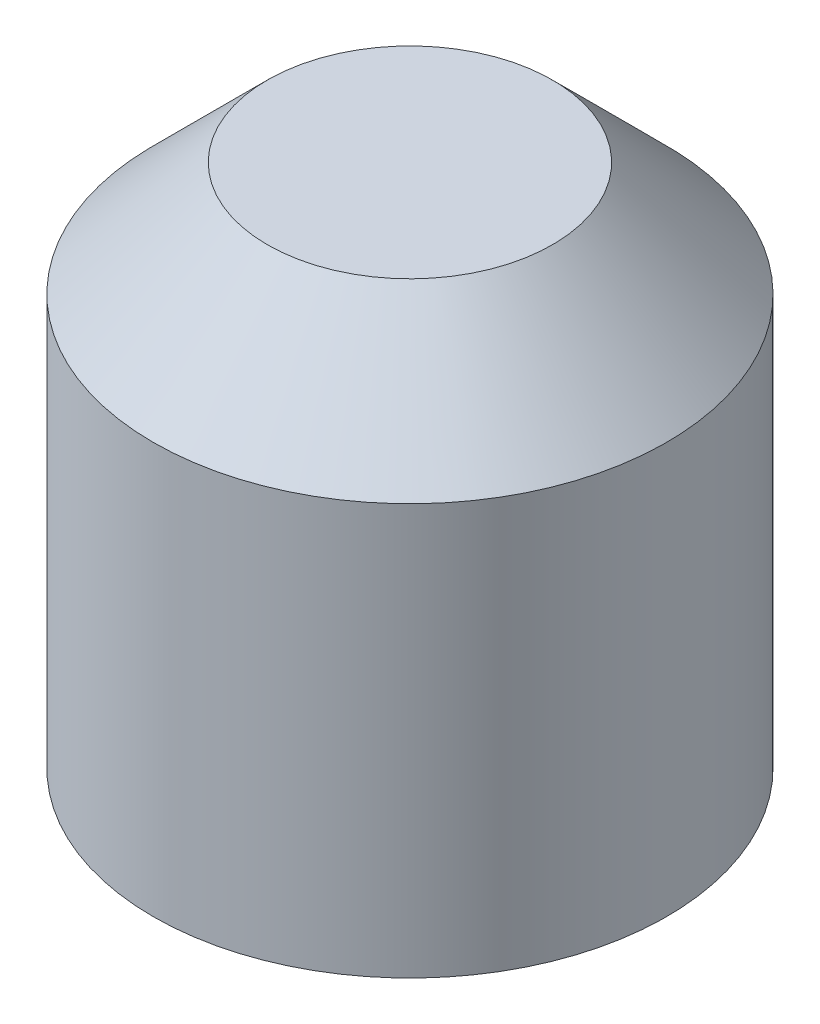
from build123d import *

# Parameters (mm, degrees)
SKETCH1_R           = 45
BOSS_EXTRUDE1_DEPTH = 92
CHAMFER1_SIZE       = 20


with BuildPart() as part:
    # Sketch1 → Boss-Extrude1 (new body)
    with BuildSketch(Plane(origin=(0, 0, 0), x_dir=(1, 0, 0), z_dir=(0, 1, 0))):
        with Locations(Location((0, 0, 0), (0, 0, 270))):
            Circle(SKETCH1_R)
    extrude(amount=BOSS_EXTRUDE1_DEPTH)

    # Chamfer1
    chamfer1_edges = [part.edges().sort_by_distance(p)[0] for p in [
        (0, 92, -45),
    ]]
    chamfer(chamfer1_edges, length=CHAMFER1_SIZE)


solid = part.part
